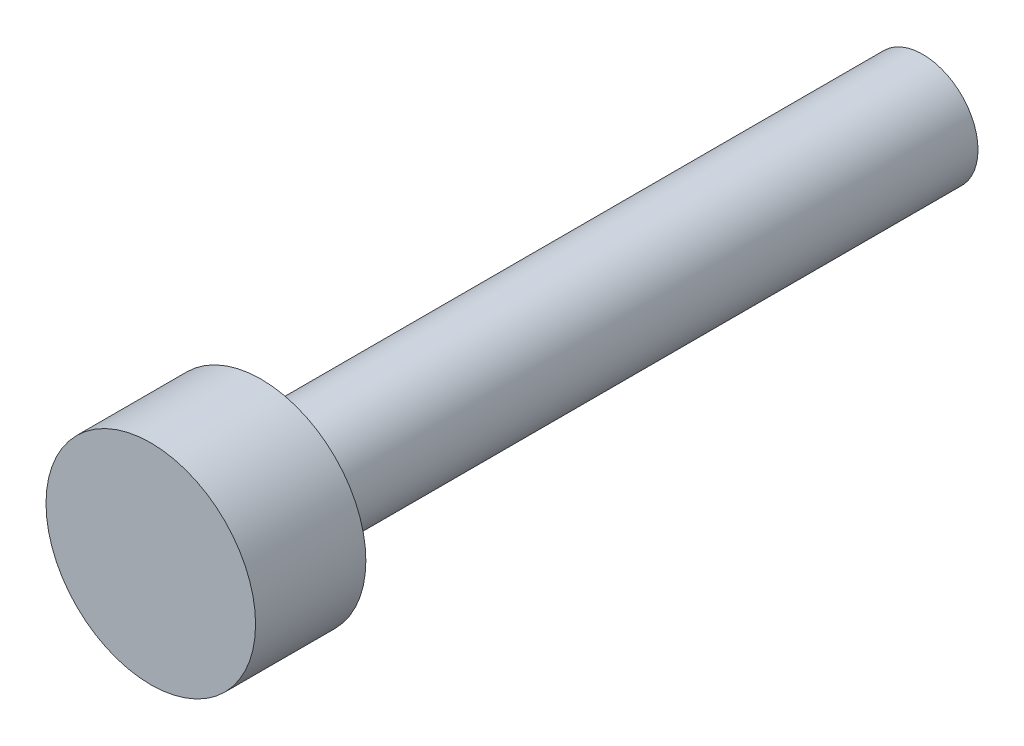
from build123d import *

# Parameters (mm, degrees)
THREAD_ENVELOPE_START = -12
SKETCH1_R             = 1
THREAD_ENVELOPE_DEPTH = 12
SKETCH2_R             = 1.9
HEAD_ENVELOPE_DEPTH   = 2


with BuildPart() as part:
    # Sketch1 → Thread_Envelope (new body)
    with BuildSketch(Plane.XY.offset(THREAD_ENVELOPE_START)):
        Circle(SKETCH1_R)
    extrude(amount=THREAD_ENVELOPE_DEPTH)

    # Sketch2 → Head_Envelope (add)
    with BuildSketch(Plane.XY):
        Circle(SKETCH2_R)
    extrude(amount=HEAD_ENVELOPE_DEPTH)


solid = part.part
